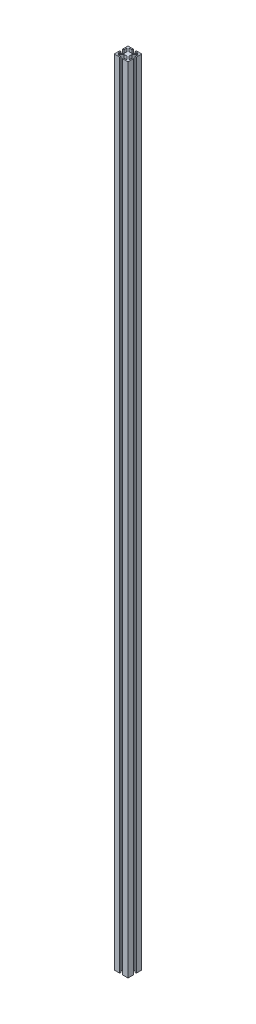
from build123d import *

# Parameters (mm, degrees)
BOSS_EXTRUDE1_DEPTH = 1470.18375


with BuildPart() as part:
    # Sketch1 → Boss-Extrude1 (new body)
    with BuildSketch(Plane(origin=(11.365010382, 0, 9.846206226), x_dir=(1, 0, 0), z_dir=(0, 1, 0))):
        Polygon((-24.065010382, 22.546206226), (-14.229795365, 22.546206226), (-14.229795365, 20.336406226), (-20.292645817, 20.336406226), (-14.310945817, 14.354706226), (-8.419074947, 14.354706226), (-2.437374947, 20.336406226), (-8.5002254, 20.336406226), (-8.5002254, 22.546206226), (1.334989618, 22.546206226), (1.334989618, 12.710991208), (-0.874810382, 12.710991208), (-0.874810382, 18.773841661), (-6.856510382, 12.792141661), (-6.856510382, 6.900270791), (-0.874810382, 0.918570791), (-0.874810382, 6.981421243), (1.334989618, 6.981421243), (1.334989618, -2.853793774), (-8.5002254, -2.853793774), (-8.5002254, -0.643993774), (-2.437374947, -0.643993774), (-8.419074947, 5.337706226), (-14.310945817, 5.337706226), (-20.292645817, -0.643993774), (-14.229795365, -0.643993774), (-14.229795365, -2.853793774), (-24.065010382, -2.853793774), (-24.065010382, 6.981421243), (-21.855210382, 6.981421243), (-21.855210382, 0.918570791), (-15.873510382, 6.900270791), (-15.873510382, 12.792141661), (-21.855210382, 18.773841661), (-21.855210382, 12.710991208), (-24.065010382, 12.710991208), align=None)
    extrude(amount=BOSS_EXTRUDE1_DEPTH)


solid = part.part
